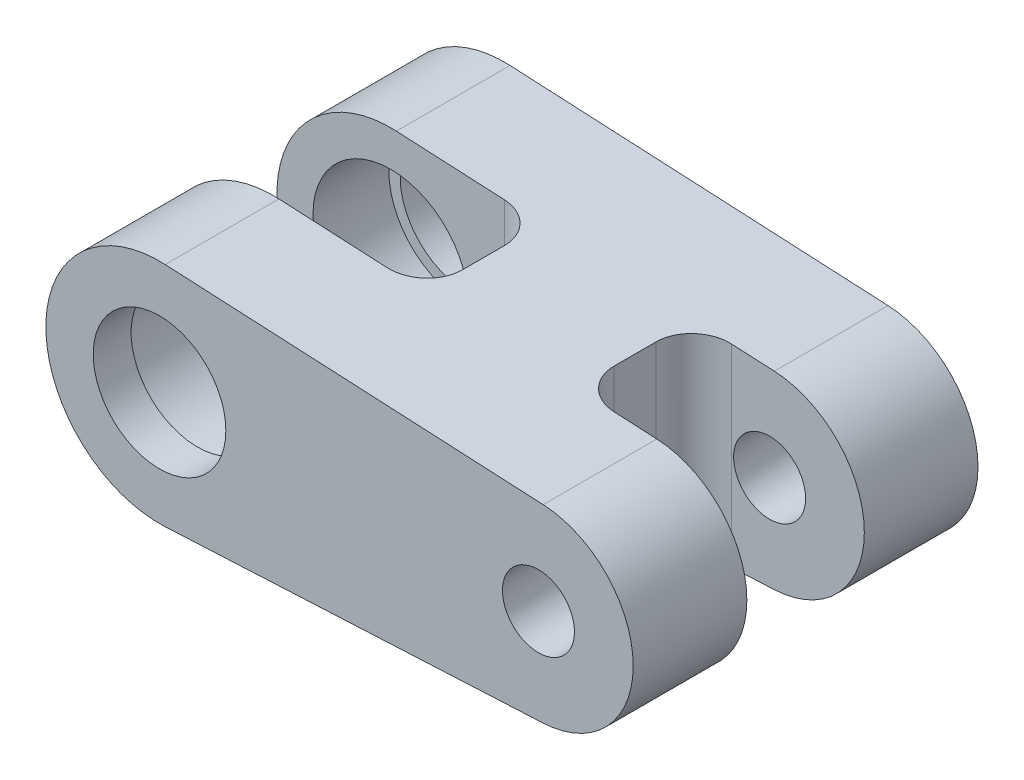
from build123d import *

# Parameters (mm, degrees)
EXTRUDE_START       = -9.1
EXTRUDE_1_DEPTH     = 6
SKETCH_4_R          = 4.1
CUT_EXTRUDE_3_DEPTH = 4
SKETCH_5_R          = 3.5
CUT_EXTRUDE_5_DEPTH = 28.349588662
SKETCH_6_R          = 1.9
CUT_EXTRUDE_6_DEPTH = 10
EXTRUDE_2_DEPTH     = 3.1
FILLET_1_R          = 2


with BuildPart() as part:
    # ｽｹｯﾁ1 → ﾎﾞｽ - 押し出し1 (new body)
    with BuildSketch(Plane.XY.offset(EXTRUDE_START)):
        with BuildLine():
            Line((0.25, 4.993746089), (-19.7, 5.992495307))
            ThreePointArc((-19.7, 5.992495307), (-26, 0), (-19.7, -5.992495307))
            Line((-19.7, -5.992495307), (0.25, -4.993746089))
            ThreePointArc((0.25, -4.993746089), (5, 0), (0.25, 4.993746089))
        make_face()
    extrude_1 = extrude(amount=EXTRUDE_1_DEPTH)

    # ｽｹｯﾁ4 → ｶｯﾄ - 押し出し3 (cut)
    with BuildSketch(Plane.XY.offset(-3.1)):
        with Locations((-20, 0)):
            Circle(SKETCH_4_R)
    cut_extrude_3 = extrude(amount=-CUT_EXTRUDE_3_DEPTH, mode=Mode.SUBTRACT)

    # ｽｹｯﾁ5 → ｶｯﾄ - 押し出し5 (cut, through all)
    with BuildSketch(Plane.XY.offset(-3.1)):
        with Locations((-20, 0)):
            Circle(SKETCH_5_R)
    cut_extrude_5 = extrude(amount=-CUT_EXTRUDE_5_DEPTH, mode=Mode.SUBTRACT)

    # ｽｹｯﾁ6 → ｶｯﾄ - 押し出し6 (cut)
    with BuildSketch(Plane.XY.offset(-3.1)):
        Circle(SKETCH_6_R)
    cut_extrude_6 = extrude(amount=-CUT_EXTRUDE_6_DEPTH, mode=Mode.SUBTRACT)

    # ｽｹｯﾁ7 → ﾎﾞｽ - 押し出し2 (add)
    with BuildSketch(Plane.XY.offset(-3.1)):
        Polygon((-4, 5.206512213), (-12, 5.607013152), (-12, -5.607013152), (-4, -5.206512213), align=None)
    extrude_2 = extrude(amount=EXTRUDE_2_DEPTH)

    # ﾐﾗｰ3: ﾎﾞｽ - 押し出し1, ｶｯﾄ - 押し出し3, ｶｯﾄ - 押し出し5, ｶｯﾄ - 押し出し6, ﾎﾞｽ - 押し出し2 across plane
    add(extrude_1.mirror(Plane.XY))
    add(cut_extrude_3.mirror(Plane.XY), mode=Mode.SUBTRACT)
    add(cut_extrude_5.mirror(Plane.XY), mode=Mode.SUBTRACT)
    add(cut_extrude_6.mirror(Plane.XY), mode=Mode.SUBTRACT)
    add(extrude_2.mirror(Plane.XY))

    # ﾌｨﾚｯﾄ1
    fillet_1_edges = [part.edges().sort_by_distance(p)[0] for p in [
        (-4, 0, -3.1),
        (-12, 0, -3.1),
        (-4, 0, 3.1),
        (-12, 0, 3.1),
    ]]
    fillet(fillet_1_edges, radius=FILLET_1_R)


solid = part.part
